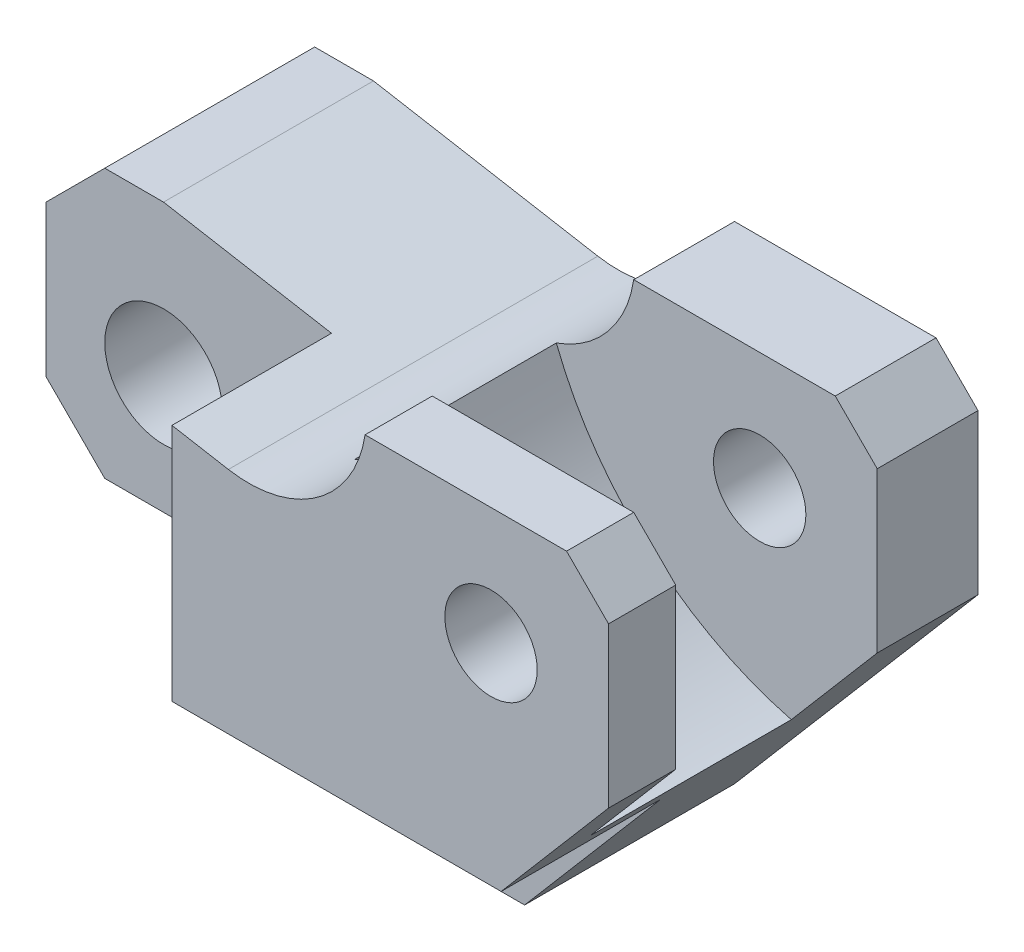
from build123d import *

# Parameters (mm, degrees)
SKETCH1_R           = 7
BOSS_EXTRUDE1_DEPTH = 44
SKETCH2_R           = 5.5
CUT_EXTRUDE1_DEPTH  = 99.636339936
CUT_EXTRUDE2_START  = -19
CUT_EXTRUDE2_DEPTH  = 19
CUT_EXTRUDE3_DEPTH  = 24


with BuildPart() as part:
    # Sketch1 → Boss-Extrude1 (new body)
    with BuildSketch(Plane.XY):
        with BuildLine():
            ThreePointArc((-40.404910175, -1.633500031), (-37.139674394, -2.846913799), (-35.459271434, -5.898205914))
            ThreePointArc((-35.459271434, -5.898205914), (-33.122441231, -13.749172092), (-28.683469034, -20.633500031))
            Line((-28.683469034, -20.633500031), (-22.980449087, -20.633500031))
            Line((-22.980449087, -20.633500031), (6.019550913, 13.366499969))
            Line((6.019550913, 13.366499969), (6.019550913, 32.366499969))
            Line((6.019550913, 32.366499969), (1.019550913, 37.366499969))
            Line((1.019550913, 37.366499969), (-22.980449087, 37.366499969))
            ThreePointArc((-22.980449087, 37.366499969), (-28.648710625, 28.077944899), (-39.256864445, 25.654410975))
            Line((-39.256864445, 25.654410975), (-65.980449087, 30.366499969))
            Line((-65.980449087, 30.366499969), (-72.980449087, 30.366499969))
            Line((-72.980449087, 30.366499969), (-79.980449087, 23.366499969))
            Line((-79.980449087, 23.366499969), (-79.980449087, 5.366499969))
            Line((-79.980449087, 5.366499969), (-72.980449087, -1.633500031))
            Line((-72.980449087, -1.633500031), (-40.404910175, -1.633500031))
        make_face()
        with Locations((-65.980449087, 12.366499969)):
            Circle(SKETCH1_R, mode=Mode.SUBTRACT)
    extrude(amount=BOSS_EXTRUDE1_DEPTH)

    # Sketch2 → Cut-Extrude1 (cut, through all)
    with BuildSketch(Plane.XY.offset(44)):
        with Locations((-7.980449087, 23.366499969)):
            Circle(SKETCH2_R)
    extrude(amount=-CUT_EXTRUDE1_DEPTH, mode=Mode.SUBTRACT)

    # Sketch3 → Cut-Extrude2 (cut)
    with BuildSketch(Plane.XY.offset(44).offset(CUT_EXTRUDE2_START)):
        Polygon((-45.980449087, 26.839960355), (-45.980449087, -1.633500031), (-72.980449087, -1.633500031), (-79.980449087, 5.366499969), (-79.980449087, 23.366499969), (-72.980449087, 30.366499969), (-65.980449087, 30.366499969), align=None)
        with BuildLine():
            Line((-40.404910175, -1.633500031), (-6.774566734, -1.633500031))
            Line((-6.774566734, -1.633500031), (-22.980449087, -20.633500031))
            Line((-22.980449087, -20.633500031), (-28.683469034, -20.633500031))
            ThreePointArc((-28.683469034, -20.633500031), (-33.122441231, -13.749172092), (-35.459271434, -5.898205914))
            ThreePointArc((-35.459271434, -5.898205914), (-37.139674394, -2.846913799), (-40.404910175, -1.633500031))
        make_face()
    extrude(amount=CUT_EXTRUDE2_DEPTH, mode=Mode.SUBTRACT)

    # Sketch7 → Cut-Extrude3 (cut)
    with BuildSketch(Plane(origin=(0, 0, 12), x_dir=(-1, 0, 0), z_dir=(0, 0, -1))):
        with BuildLine():
            Line((-6.019550913, 13.366499969), (4.215743204, 1.366499969))
            ThreePointArc((4.215743204, 1.366499969), (21.210918642, 10.417084234), (32.200340902, 26.227892629))
            ThreePointArc((32.200340902, 26.227892629), (26.041094158, 30.514775107), (22.980449087, 37.366499969))
            Line((22.980449087, 37.366499969), (-1.019550913, 37.366499969))
            Line((-1.019550913, 37.366499969), (-6.019550913, 32.366499969))
            Line((-6.019550913, 32.366499969), (-6.019550913, 13.366499969))
        make_face()
    extrude(amount=-CUT_EXTRUDE3_DEPTH, mode=Mode.SUBTRACT)


solid = part.part
